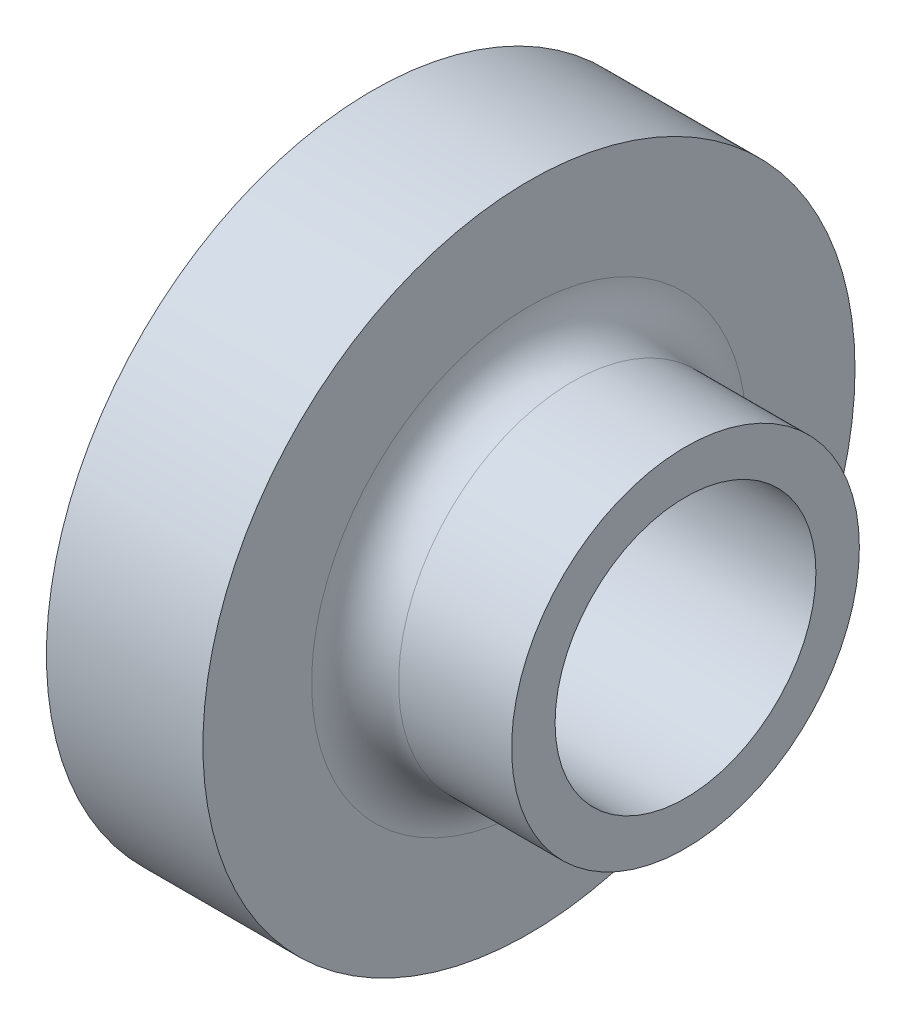
from build123d import *

# Parameters (mm, degrees)
FILLET1_R = 5


with BuildPart() as part:
    # Sketch2 → Revolve1 (revolve)
    with BuildSketch(Plane.XY, mode=Mode.PRIVATE) as revolve1_sk:
        Polygon((13.959126053, 37.5), (31.959126053, 37.5), (31.959126053, 20), (49.959136156, 20), (49.959136156, 15), (13.959126053, 15), align=None)
    revolve(revolve1_sk.sketch.rotate(Axis((66.86585888, 0, 0), (-1, 0, 0)), 90), axis=Axis((66.86585888, 0, 0), (-1, 0, 0)))

    # Fillet1
    fillet1_edges = [part.edges().sort_by_distance(p)[0] for p in [
        (31.959126053, 0, 20),
    ]]
    fillet(fillet1_edges, radius=FILLET1_R)


solid = part.part
